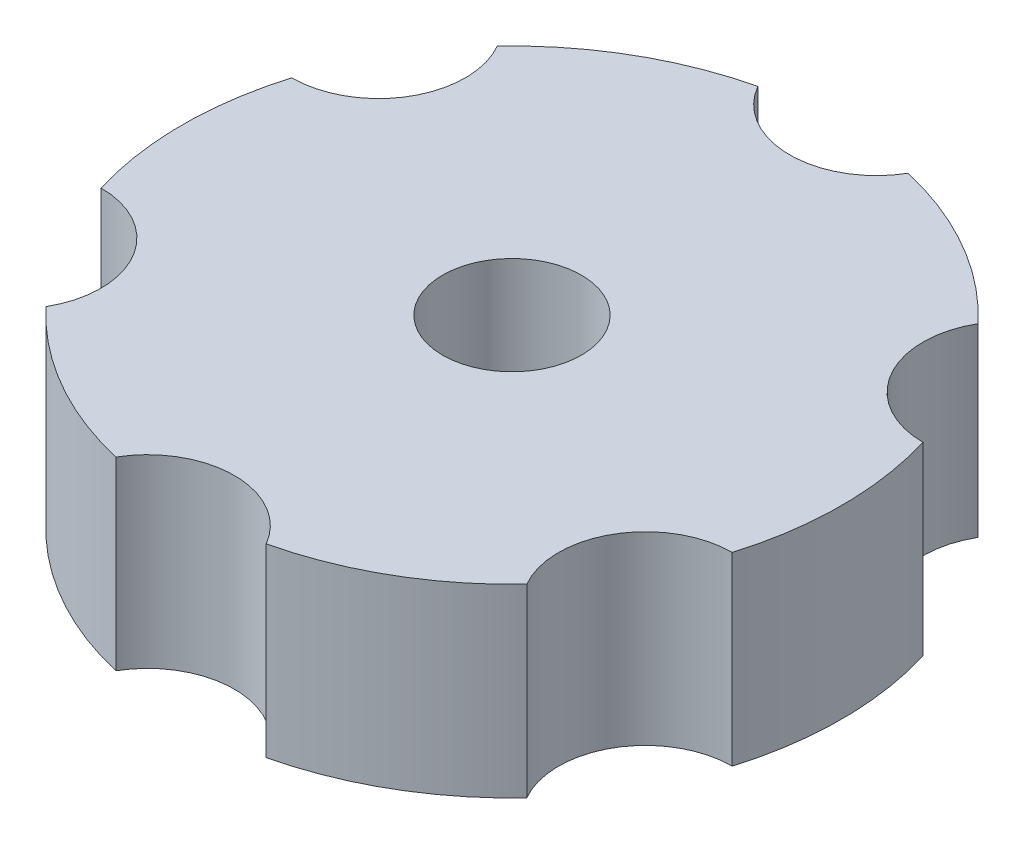
from build123d import *

# Parameters (mm, degrees)
CROQUIS1_R              = 6
SALIENTE_EXTRUIR1_DEPTH = 16


with BuildPart() as part:
    # Croquis1 → Saliente-Extruir1 (new body)
    with BuildSketch(Plane(origin=(0, 0, 0), x_dir=(1, 0, 0), z_dir=(0, 1, 0))):
        with BuildLine():
            ThreePointArc((27.281229681, -8.245271801), (28.193661042, -4.167430508), (28.5, 0))
            ThreePointArc((28.5, 0), (28.193661042, 4.167430508), (27.281229681, 8.245271801))
            ThreePointArc((27.281229681, 8.245271801), (20.784609691, 12), (20.781229681, 19.50360205))
            ThreePointArc((20.781229681, 19.50360205), (14.25, 24.681724008), (6.5, 27.748873851))
            ThreePointArc((6.5, 27.748873851), (0, 24), (-6.5, 27.748873851))
            ThreePointArc((-6.5, 27.748873851), (-14.25, 24.681724008), (-20.781229681, 19.50360205))
            ThreePointArc((-20.781229681, 19.50360205), (-20.033536457, 17.695055573), (-19.778532486, 15.754731247))
            ThreePointArc((-19.778532486, 15.754731247), (-21.975611771, 10.447131827), (-27.281229681, 8.245271801))
            ThreePointArc((-27.281229681, 8.245271801), (-28.5, 0), (-27.281229681, -8.245271801))
            ThreePointArc((-27.281229681, -8.245271801), (-21.975611771, -10.447131827), (-19.778532486, -15.754731247))
            ThreePointArc((-19.778532486, -15.754731247), (-20.033536457, -17.695055573), (-20.781229681, -19.50360205))
            ThreePointArc((-20.781229681, -19.50360205), (-14.25, -24.681724008), (-6.5, -27.748873851))
            ThreePointArc((-6.5, -27.748873851), (0, -24), (6.5, -27.748873851))
            ThreePointArc((6.5, -27.748873851), (14.25, -24.681724008), (20.781229681, -19.50360205))
            ThreePointArc((20.781229681, -19.50360205), (20.784609691, -12), (27.281229681, -8.245271801))
        make_face()
        with Locations(Location((0, 0, 0), (0, 0, 270))):
            Circle(CROQUIS1_R, mode=Mode.SUBTRACT)
    extrude(amount=SALIENTE_EXTRUIR1_DEPTH)


solid = part.part
